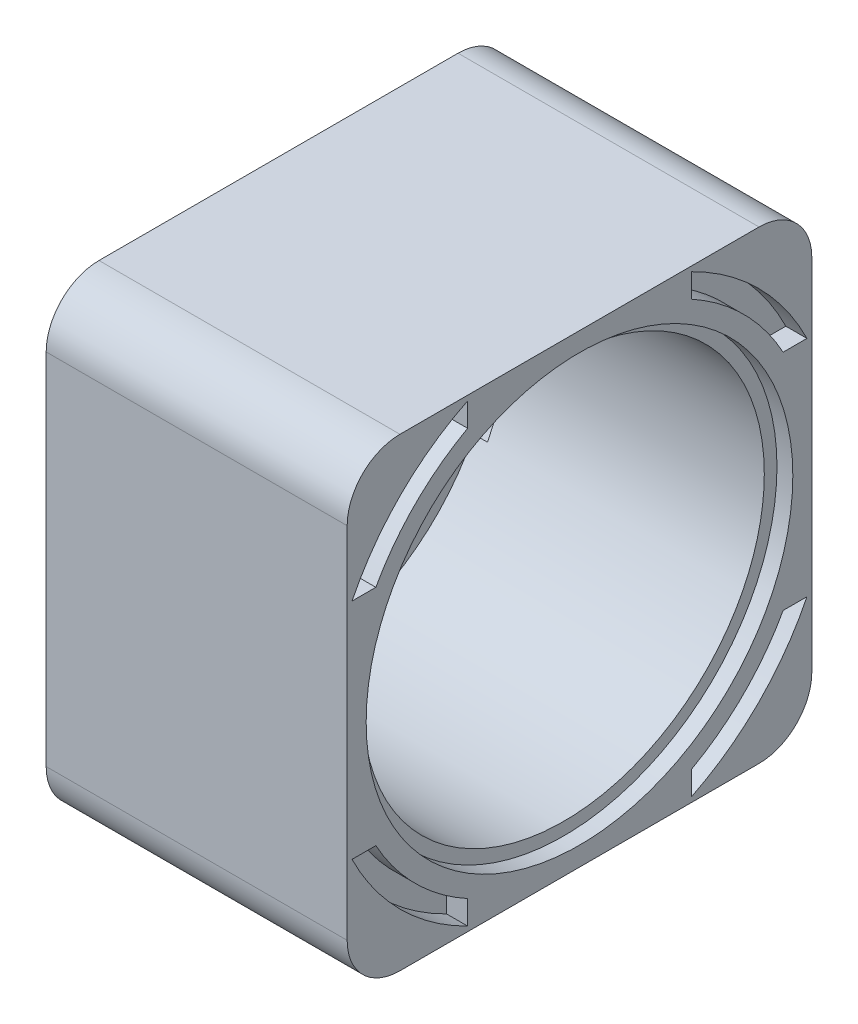
from build123d import *

# Parameters (mm, degrees)
SKETCH_1_W          = 44
SKETCH_1_H          = 44
EXTRUDE_1_DEPTH     = 1.5
SKETCH_2_R          = 2.5
SKETCH_2_R_2        = 1
EXTRUDE_2_DEPTH     = 3
SKETCH_3_R          = 2.5
SKETCH_3_R_2        = 1
EXTRUDE_3_DEPTH     = 3.5
SKETCH_4_W          = 44
SKETCH_4_H          = 44
SKETCH_4_R          = 19
EXTRUDE_4_DEPTH     = 27
CUT_EXTRUDE_START   = -1.5
SKETCH_5_R          = 20.2
SKETCH_5_R_2        = 19
CUT_EXTRUDE_1_DEPTH = 1.5
FILLET_2_R          = 5
CUT_EXTRUDE_START_2 = -10
SKETCH_10_W         = 1.3
SKETCH_10_H         = 17
CUT_EXTRUDE_5_DEPTH = 33.1930089
CUT_EXTRUDE_7_DEPTH = 2


with BuildPart() as part:
    # 草图1 → 凸台-拉伸1 (new body)
    with BuildSketch(Plane(origin=(0, 0, 0), x_dir=(0, 0, -1), z_dir=(1, 0, 0))):
        Rectangle(SKETCH_1_W, SKETCH_1_H)
    extrude(amount=EXTRUDE_1_DEPTH)

    # 草图2 → 凸台-拉伸2 (add)
    # profile 1 of 2: a face of its own
    with BuildSketch(Plane(origin=(1.5, 0, 0), x_dir=(0, 0, -1), z_dir=(1, 0, 0))):
        with Locations((0, -10.5)):
            Circle(SKETCH_2_R)
        with Locations((0, -10.5)):
            Circle(SKETCH_2_R_2, mode=Mode.SUBTRACT)
    # profile 2 of 2: a face of its own
    with BuildSketch(Plane(origin=(1.5, 0, 0), x_dir=(0, 0, -1), z_dir=(1, 0, 0))):
        with Locations((0, 10.5)):
            Circle(SKETCH_2_R)
        with Locations((0, 10.5)):
            Circle(SKETCH_2_R_2, mode=Mode.SUBTRACT)
    extrude(amount=EXTRUDE_2_DEPTH)

    # 草图3 → 凸台-拉伸3 (add)
    # profile 1 of 2: a face of its own
    with BuildSketch(Plane(origin=(1.5, 0, 0), x_dir=(0, 0, -1), z_dir=(1, 0, 0))):
        with Locations((-12.5, -10.5)):
            Circle(SKETCH_3_R)
        with Locations((-12.5, -10.5)):
            Circle(SKETCH_3_R_2, mode=Mode.SUBTRACT)
    # profile 2 of 2: a face of its own
    with BuildSketch(Plane(origin=(1.5, 0, 0), x_dir=(0, 0, -1), z_dir=(1, 0, 0))):
        with Locations((-12.5, 10.5)):
            Circle(SKETCH_3_R)
        with Locations((-12.5, 10.5)):
            Circle(SKETCH_3_R_2, mode=Mode.SUBTRACT)
    extrude(amount=EXTRUDE_3_DEPTH)

    # 草图4 → 凸台-拉伸4 (add)
    with BuildSketch(Plane(origin=(1.5, 0, 0), x_dir=(0, 0, -1), z_dir=(1, 0, 0))):
        Rectangle(SKETCH_4_W, SKETCH_4_H)
        Circle(SKETCH_4_R, mode=Mode.SUBTRACT)
    extrude(amount=EXTRUDE_4_DEPTH)

    # 草图5 → 切除-拉伸1 (cut)
    with BuildSketch(Plane(origin=(28.5, 0, 0), x_dir=(0, 0, -1), z_dir=(1, 0, 0)).offset(CUT_EXTRUDE_START)):
        Circle(SKETCH_5_R)
        Circle(SKETCH_5_R_2, mode=Mode.SUBTRACT)
    extrude(amount=CUT_EXTRUDE_1_DEPTH, mode=Mode.SUBTRACT)

    # 圆角2
    fillet_2_edges = [part.edges().sort_by_distance(p)[0] for p in [
        (14.25, -22, 22),
        (14.25, -22, -22),
        (14.25, 22, -22),
        (14.25, 22, 22),
    ]]
    fillet(fillet_2_edges, radius=FILLET_2_R)

    # 草图10 → 切除-拉伸5 (cut, through all)
    with BuildSketch(Plane.XY.offset(CUT_EXTRUDE_START_2)):
        with Locations((2.15, 0)):
            Rectangle(SKETCH_10_W, SKETCH_10_H)
    extrude(amount=-CUT_EXTRUDE_5_DEPTH, mode=Mode.SUBTRACT)

    # 草图13 → 切除-拉伸7 (cut)
    with BuildSketch(Plane(origin=(28.5, 0, 0), x_dir=(0, 0, -1), z_dir=(1, 0, 0))):
        with BuildLine():
            Line((-10.591663047, 21.536403458), (-10.591663047, 19.282548429))
            ThreePointArc((-10.591663047, 19.282548429), (-15.556349186, 15.556349186), (-19.282548429, 10.591663047))
            Line((-19.282548429, 10.591663047), (-21.536403458, 10.591663047))
            ThreePointArc((-21.536403458, 10.591663047), (-16.970562748, 16.970562748), (-10.591663047, 21.536403458))
        make_face()
        with BuildLine():
            Line((10.591663047, 21.536403458), (10.591663047, 19.282548429))
            ThreePointArc((10.591663047, 19.282548429), (15.556349186, 15.556349186), (19.282548429, 10.591663047))
            Line((19.282548429, 10.591663047), (21.536403458, 10.591663047))
            ThreePointArc((21.536403458, 10.591663047), (16.970562748, 16.970562748), (10.591663047, 21.536403458))
        make_face()
        with BuildLine():
            Line((-21.536403458, -10.591663047), (-19.282548429, -10.591663047))
            ThreePointArc((-19.282548429, -10.591663047), (-15.556349186, -15.556349186), (-10.591663047, -19.282548429))
            Line((-10.591663047, -19.282548429), (-10.591663047, -21.536403458))
            ThreePointArc((-10.591663047, -21.536403458), (-16.970562748, -16.970562748), (-21.536403458, -10.591663047))
        make_face()
        with BuildLine():
            Line((21.536403458, -10.591663047), (19.282548429, -10.591663047))
            ThreePointArc((19.282548429, -10.591663047), (15.556349186, -15.556349186), (10.591663047, -19.282548429))
            Line((10.591663047, -19.282548429), (10.591663047, -21.536403458))
            ThreePointArc((10.591663047, -21.536403458), (16.970562748, -16.970562748), (21.536403458, -10.591663047))
        make_face()
    extrude(amount=-CUT_EXTRUDE_7_DEPTH, mode=Mode.SUBTRACT)


solid = part.part
